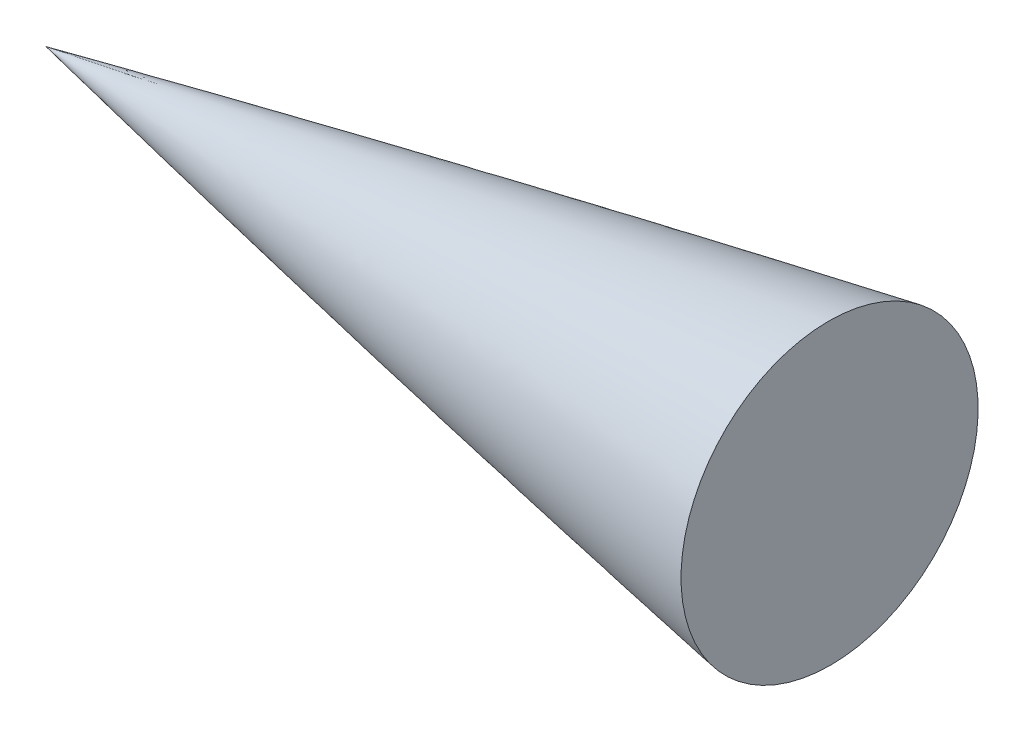
from build123d import *


with BuildPart() as part:
    # Sketch1 → Revolve1 (revolve)
    with BuildSketch(Plane.XY):
        with BuildLine():
            Line((0, 0), (100, 0.642912383))
            Line((100, 0.642912383), (100, 19.622912383))
            add(Edge.make_bspline(
                [(0, 0), (0.990082122, 0.208734408), (2.917321851, 0.613942147), (7.770673951, 1.632188347), (11.487935376, 2.402636163), (16.861049588, 3.51557411), (21.240287439, 4.412332425), (26.221556, 5.429436916), (30.841810928, 6.363739606), (35.680366537, 7.337563484), (40.392862632, 8.277996824), (45.176849704, 9.227203268), (49.931009033, 10.162972859), (54.686305455, 11.093235244), (59.474172905, 12.022306057), (64.192703457, 12.932513583), (69.040307639, 13.859398495), (73.67127422, 14.740451297), (78.667106579, 15.681150546), (83.061164962, 16.505958655), (88.455319076, 17.505888239), (92.189791111, 18.197662712), (97.066226563, 19.088710502), (99.004456614, 19.442009237), (100, 19.622912383)],
                knots=[0.08282527, 0.08282527, 0.08282527, 0.08282527, 0.08282527, 0.122540381, 0.162255492, 0.201970602, 0.241685713, 0.281400823, 0.321115933, 0.360831044, 0.400546155, 0.440261265, 0.479976376, 0.519691486, 0.559406596, 0.599121707, 0.638836817, 0.678551927, 0.718267038, 0.757982149, 0.797697259, 0.83741237, 0.87712748, 0.91684259, 0.91684259, 0.91684259, 0.91684259, 0.91684259], degree=4))
        make_face()
    revolve(axis=Axis((0, 0, 0), (0.9999793338240378, 0.006428990965440526, 0)))


solid = part.part
